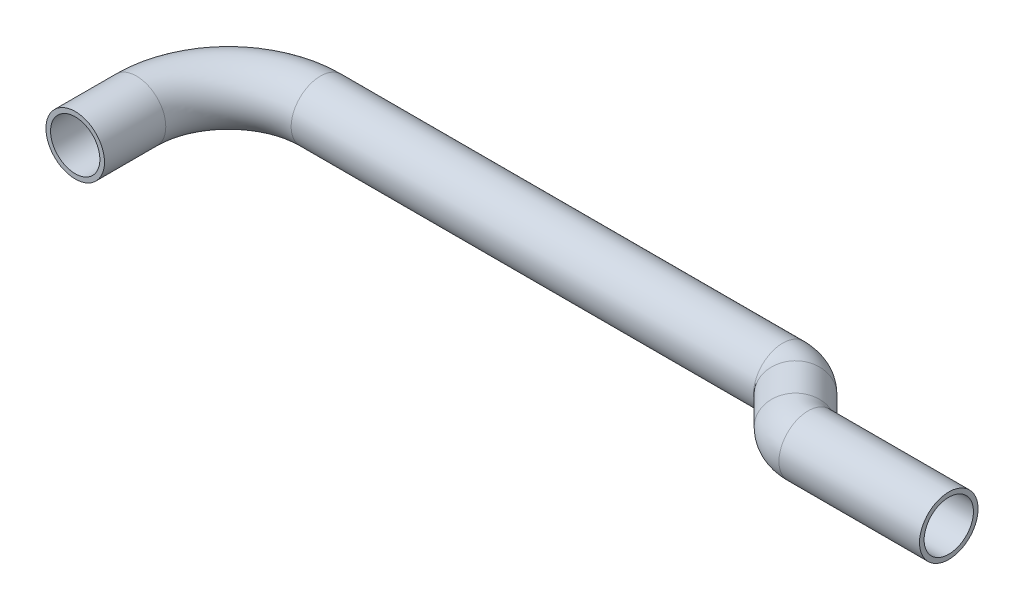
from build123d import *

# Parameters (mm, degrees)
SKETCH2_R   = 9.55
SKETCH2_R_2 = 8.05


with BuildPart() as part:
    # Sweep1: sweep along a path in Sketch1
    with BuildLine(Plane(origin=(0, 0, 0), x_dir=(1, 0, 0), z_dir=(0, 1, 0))) as sweep1_path:
        Line((250, 35), (204.142135624, 35))
        ThreePointArc((204.142135624, 35), (200.3153013, 35.761204675), (197.071067812, 37.928932188))
        Line((197.071067812, 37.928932188), (187.928932188, 47.071067812))
        ThreePointArc((187.928932188, 47.071067812), (184.6846987, 49.238795325), (180.857864376, 50))
        Line((180.857864376, 50), (30, 50))
        ThreePointArc((30, 50), (8.786796564, 41.213203436), (0, 20))
        Line((0, 20), (0, 0))
    # Sketch2 → Sweep1 (sweep)
    with BuildSketch(Plane.XY):
        Circle(SKETCH2_R)
        Circle(SKETCH2_R_2, mode=Mode.SUBTRACT)
    sweep(path=sweep1_path.line)


solid = part.part
